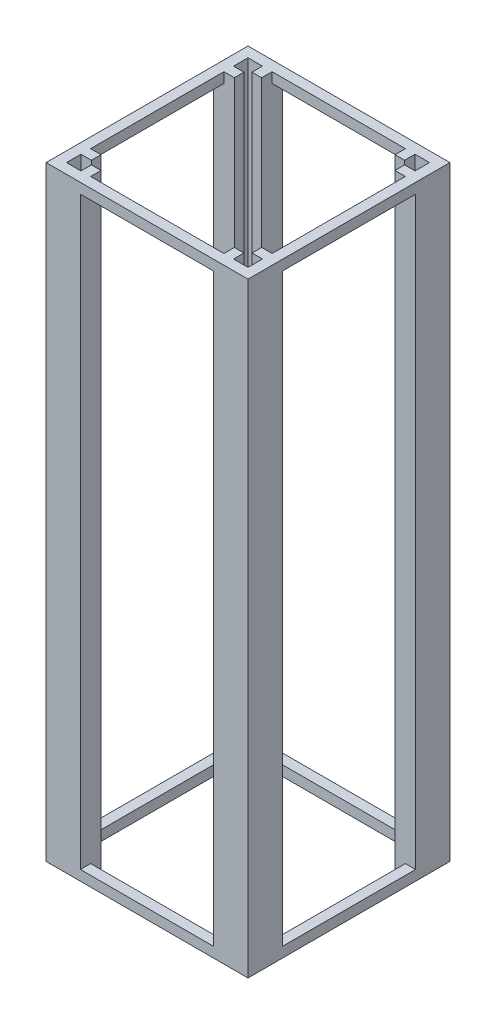
from build123d import *

# Parameters (mm, degrees)
SKETCH1_W           = 125.7
SKETCH1_H           = 125.7
BOSS_EXTRUDE1_DEPTH = 376.8
SKETCH3_W           = 83
SKETCH3_H           = 364.1
CUT_EXTRUDE1_DEPTH  = 126.35
SKETCH5_W           = 83
SKETCH5_H           = 364.1
CUT_EXTRUDE2_DEPTH  = 126.35


with BuildPart() as part:
    # Sketch1 → Boss-Extrude1 (new body)
    with BuildSketch(Plane(origin=(0, 0, 0), x_dir=(1, 0, 0), z_dir=(0, 1, 0))):
        Rectangle(SKETCH1_W, SKETCH1_H)
        Polygon((-47.5, -56.5), (-47.5, -50), (-41.5, -50), (-41.5, -56.5), (41.5, -56.5), (41.5, -50), (47.5, -50), (47.5, -56.5), (56.5, -56.5), (56.5, -47.5), (50, -47.5), (50, -41.5), (56.5, -41.5), (56.5, 41.5), (50, 41.5), (50, 47.5), (56.5, 47.5), (56.5, 56.5), (47.5, 56.5), (47.5, 50), (41.5, 50), (41.5, 56.5), (-41.5, 56.5), (-41.5, 50), (-47.5, 50), (-47.5, 56.5), (-56.5, 56.5), (-56.5, 47.5), (-50, 47.5), (-50, 41.5), (-56.5, 41.5), (-56.5, -41.5), (-50, -41.5), (-50, -47.5), (-56.5, -47.5), (-56.5, -56.5), align=None, mode=Mode.SUBTRACT)
    extrude(amount=BOSS_EXTRUDE1_DEPTH)

    # Sketch3 → Cut-Extrude1 (cut)
    with BuildSketch(Plane(origin=(62.85, 0, 0), x_dir=(0, 0, -1), z_dir=(1, 0, 0))):
        with Locations((0, 188.4)):
            Rectangle(SKETCH3_W, SKETCH3_H)
    extrude(amount=-CUT_EXTRUDE1_DEPTH, mode=Mode.SUBTRACT)

    # Sketch5 → Cut-Extrude2 (cut)
    with BuildSketch(Plane.XY.offset(62.85)):
        with Locations((0, 188.4)):
            Rectangle(SKETCH5_W, SKETCH5_H)
    extrude(amount=-CUT_EXTRUDE2_DEPTH, mode=Mode.SUBTRACT)


solid = part.part
